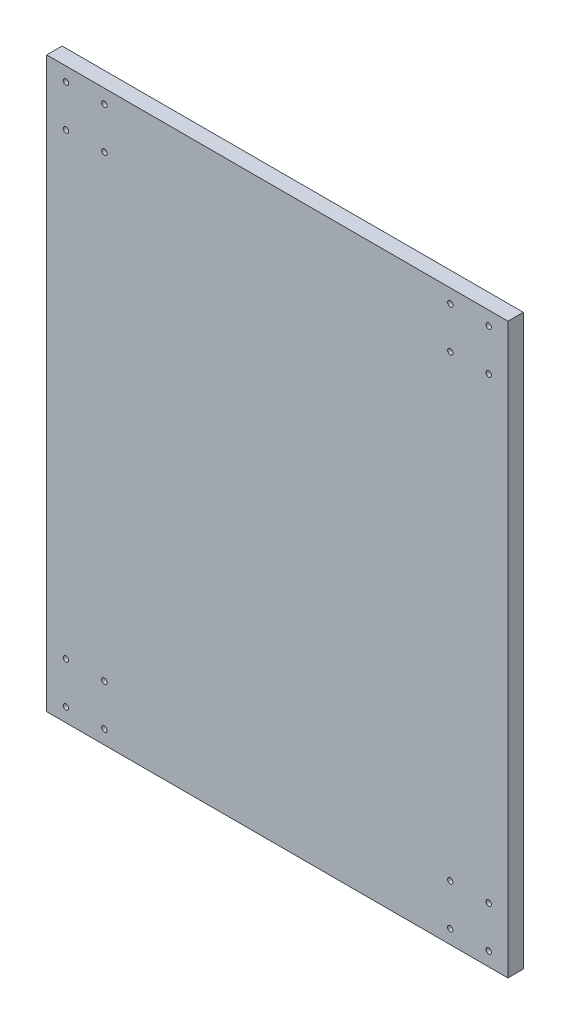
from build123d import *

# Parameters (mm, degrees)
SKETCH_1_W      = 600
SKETCH_1_H      = 740
SKETCH_1_R      = 3.5
EXTRUDE_1_DEPTH = 20


with BuildPart() as part:
    # Эскиз1 → Бобышка-Вытянуть1 (new body)
    with BuildSketch(Plane.XY):
        Rectangle(SKETCH_1_W, SKETCH_1_H)
        with Locations((-275, -352)):
            Circle(SKETCH_1_R, mode=Mode.SUBTRACT)
        with Locations((-225, -352)):
            Circle(SKETCH_1_R, mode=Mode.SUBTRACT)
        with Locations((-275, -298)):
            Circle(SKETCH_1_R, mode=Mode.SUBTRACT)
        with Locations((-225, -298)):
            Circle(SKETCH_1_R, mode=Mode.SUBTRACT)
        with Locations((225, -352)):
            Circle(SKETCH_1_R, mode=Mode.SUBTRACT)
        with Locations((275, -352)):
            Circle(SKETCH_1_R, mode=Mode.SUBTRACT)
        with Locations((225, -298)):
            Circle(SKETCH_1_R, mode=Mode.SUBTRACT)
        with Locations((275, -298)):
            Circle(SKETCH_1_R, mode=Mode.SUBTRACT)
        with Locations((-275, 298)):
            Circle(SKETCH_1_R, mode=Mode.SUBTRACT)
        with Locations((-225, 298)):
            Circle(SKETCH_1_R, mode=Mode.SUBTRACT)
        with Locations((-275, 352)):
            Circle(SKETCH_1_R, mode=Mode.SUBTRACT)
        with Locations((-225, 352)):
            Circle(SKETCH_1_R, mode=Mode.SUBTRACT)
        with Locations((225, 298)):
            Circle(SKETCH_1_R, mode=Mode.SUBTRACT)
        with Locations((275, 298)):
            Circle(SKETCH_1_R, mode=Mode.SUBTRACT)
        with Locations((225, 352)):
            Circle(SKETCH_1_R, mode=Mode.SUBTRACT)
        with Locations((275, 352)):
            Circle(SKETCH_1_R, mode=Mode.SUBTRACT)
    extrude(amount=EXTRUDE_1_DEPTH)


solid = part.part
